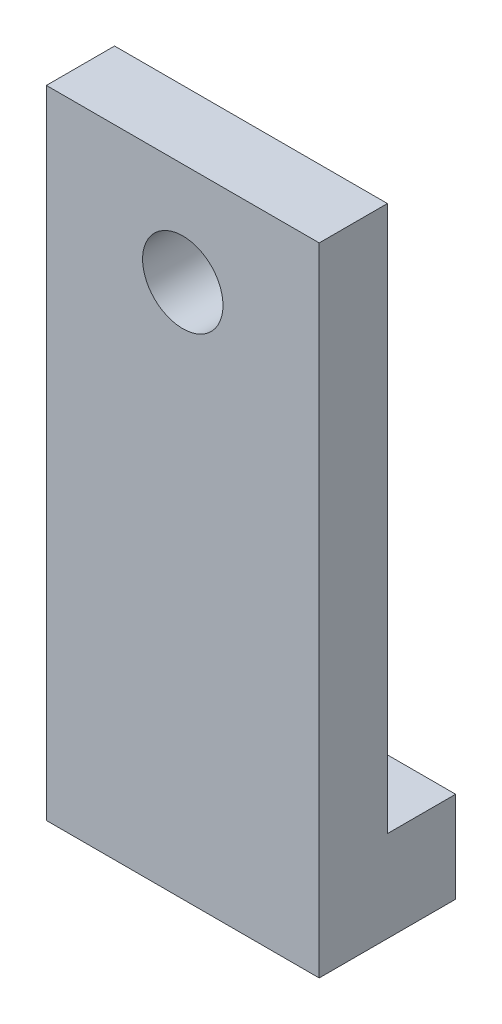
from build123d import *

# Parameters (mm, degrees)
EXTRUDE1_DEPTH         = 19.05
F_10_CLEARANCE_HOLE1_D = 5.6134


with BuildPart() as part:
    # Sketch1 → Extrude1 (new body)
    with BuildSketch(Plane(origin=(0, 0, 0), x_dir=(0, 0, -1), z_dir=(1, 0, 0))):
        Polygon((0, 0), (-9.525, 0), (-9.525, 44.45), (-4.7625, 44.45), (-4.7625, 6.35), (0, 6.35), align=None)
    extrude(amount=EXTRUDE1_DEPTH)

    # #10 Clearance Hole1 (through all)
    with Locations(Plane.XY.offset(9.525)):
        with Locations((9.525, 37.30625)):
            Hole(F_10_CLEARANCE_HOLE1_D / 2)


solid = part.part
